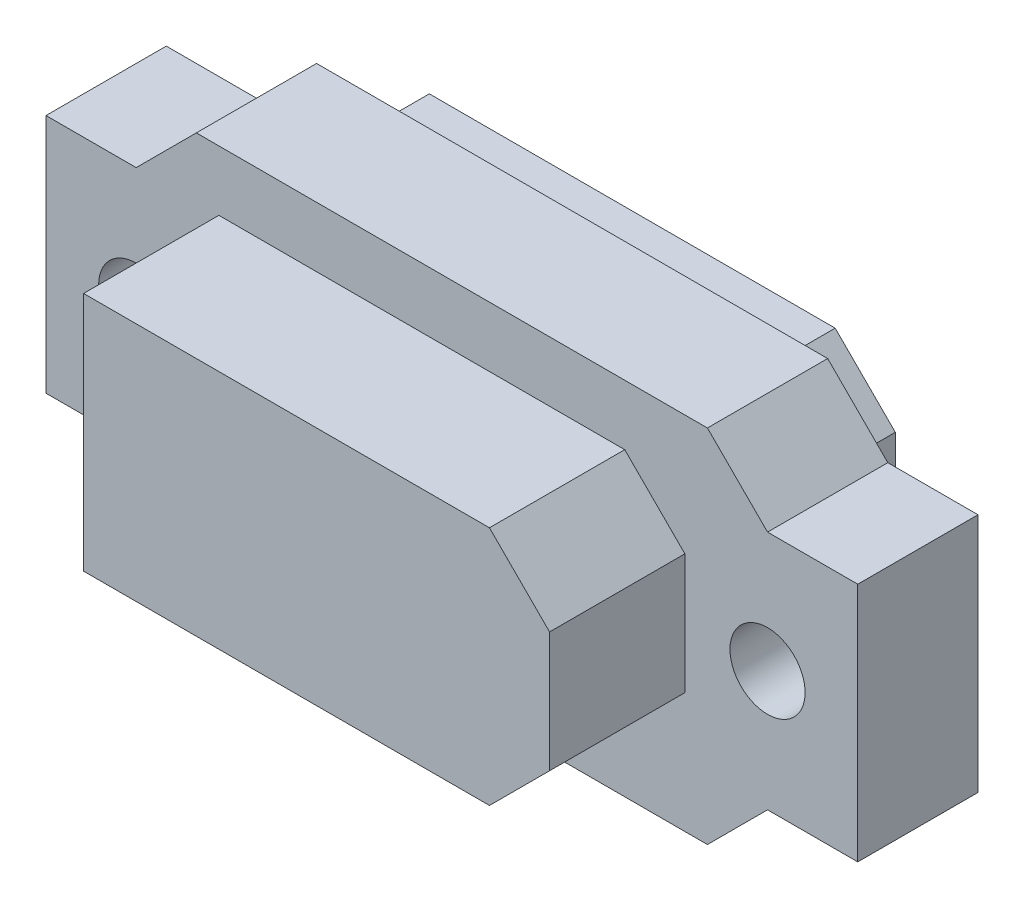
from build123d import *

# Parameters (mm, degrees)
BOSS_EXTRUDE1_DEPTH = 11.5
SKETCH2_R           = 1.25
BOSS_EXTRUDE2_DEPTH = 4
BOSS_EXTRUDE3_DEPTH = 2
SKETCH4_R           = 1.139512492
SKETCH4_R_2         = 1.383403708
BOSS_EXTRUDE4_DEPTH = 9


with BuildPart() as part:
    # Sketch1 → Boss-Extrude1 (new body)
    with BuildSketch(Plane.XY):
        Polygon((5.75, -4), (7.75, -2), (7.75, 2), (5.75, 4), (-7.75, 4), (-7.75, -4), align=None)
        Polygon((-7.25, 3.5), (-7.25, -3.5), (5.542893219, -3.5), (7.25, -1.792893219), (7.25, 1.792893219), (5.542893219, 3.5), align=None, mode=Mode.SUBTRACT)
    extrude(amount=BOSS_EXTRUDE1_DEPTH)

    # Sketch2 → Boss-Extrude2 (add)
    with BuildSketch(Plane(origin=(0, 0, 3), x_dir=(-1, 0, 0), z_dir=(0, 0, -1))):
        Polygon((-13.5, 0), (-13.5, 4), (-10.5, 4), (-8.5, 6), (8.5, 6), (10.5, 4), (13.5, 4), (13.5, 0), (13.5, -4), (10.5, -4), (8.5, -6), (-8.5, -6), (-10.5, -4), (-13.5, -4), align=None)
        with Locations((-10.5, 0)):
            Circle(SKETCH2_R, mode=Mode.SUBTRACT)
        with Locations((10.5, 0)):
            Circle(SKETCH2_R, mode=Mode.SUBTRACT)
        Polygon((-5.75, -4), (7.75, -4), (7.75, 4), (-5.75, 4), (-7.75, 2), (-7.75, -2), align=None, mode=Mode.SUBTRACT)
    extrude(amount=-BOSS_EXTRUDE2_DEPTH)

    # Sketch3 → Boss-Extrude3 (add)
    with BuildSketch(Plane.XY.offset(11.5)):
        Polygon((-7.25, 3.5), (-7.25, -3.5), (5.542893219, -3.5), (7.25, -1.792893219), (7.25, 1.792893219), (5.542893219, 3.5), align=None)
    extrude(amount=-BOSS_EXTRUDE3_DEPTH)

    # Sketch4 → Boss-Extrude4 (add)
    with BuildSketch(Plane(origin=(0, 0, 9.5), x_dir=(-1, 0, 0), z_dir=(0, 0, -1))):
        with Locations(Location((-4.01250784, 0, 0), (0, 0, 180))):
            Circle(SKETCH4_R)
        with Locations(Location((3.818130298, 0, 0), (0, 0, 180))):
            Circle(SKETCH4_R_2)
    extrude(amount=BOSS_EXTRUDE4_DEPTH)


solid = part.part
